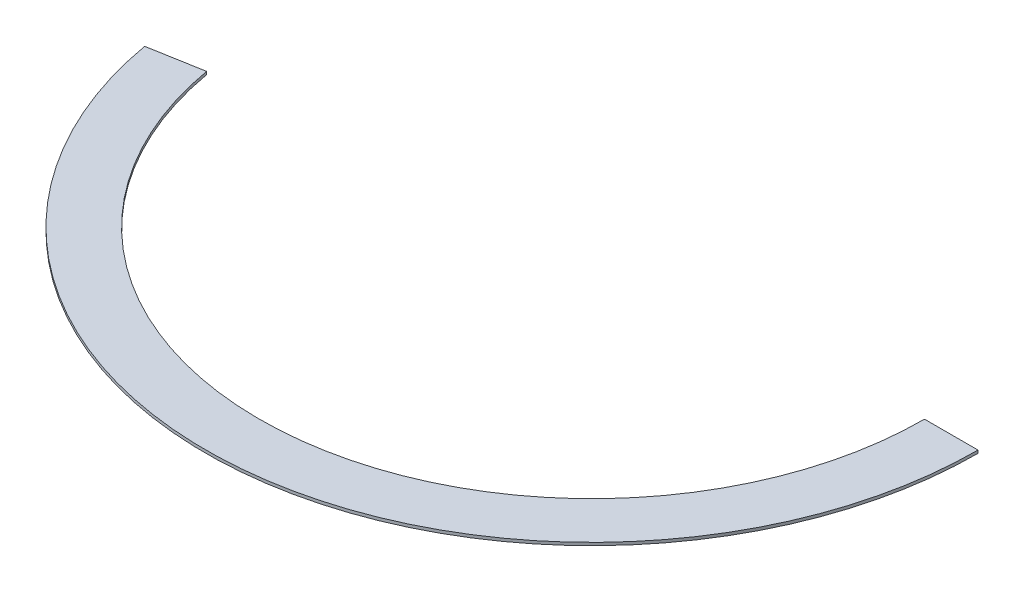
from build123d import *

# Parameters (mm, degrees)
BOSS_EXTRUDE1_DEPTH = 0.7


with BuildPart() as part:
    # Sketch3 → Boss-Extrude1 (new body)
    with BuildSketch(Plane(origin=(0, 0, 0), x_dir=(1, 0, 0), z_dir=(0, 1, 0))):
        with BuildLine():
            Line((-79.602010676, -14.035982201), (-92.404511465, -16.29340851))
            ThreePointArc((-92.404511465, -16.29340851), (8.177823342, -93.472948522), (93.83, 0))
            Line((93.83, 0), (80.83, 0))
            ThreePointArc((80.83, 0), (7.044798686, -80.522417447), (-79.602010676, -14.035982201))
        make_face()
    extrude(amount=BOSS_EXTRUDE1_DEPTH)


solid = part.part
